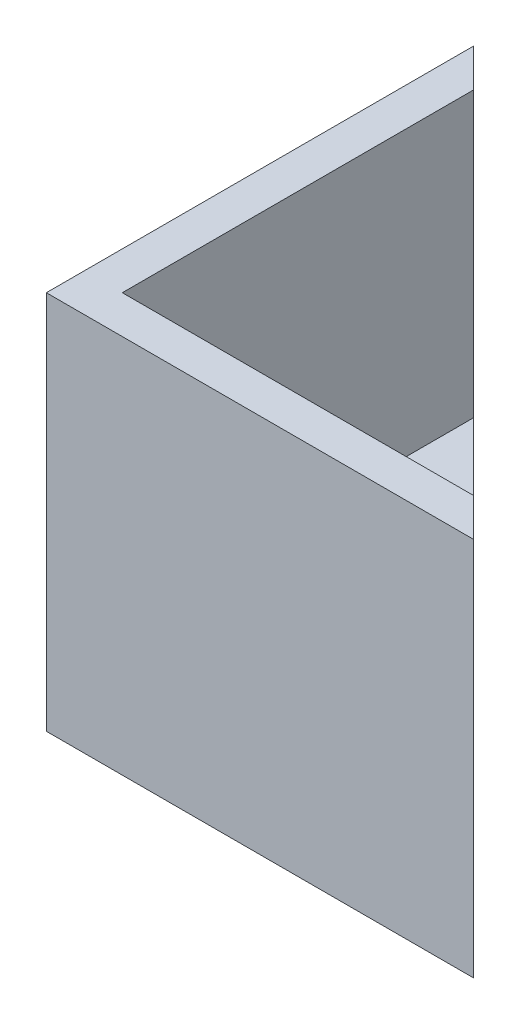
from build123d import *

# Parameters (mm, degrees)
BOSS_EXTRUDE1_DEPTH = 10.1
BOSS_EXTRUDE2_DEPTH = 29.9
CUT_EXTRUDE1_DEPTH  = 6.1
CUT_EXTRUDE2_DEPTH  = 71.313654435


with BuildPart() as part:
    # Sketch1 → Boss-Extrude1 (new body)
    with BuildSketch(Plane(origin=(0, 0, 0), x_dir=(1, 0, 0), z_dir=(0, 1, 0))):
        Polygon((0, 0), (45, 0), (0, 45), align=None)
    extrude(amount=BOSS_EXTRUDE1_DEPTH)

    # Sketch2 → Boss-Extrude2 (add)
    with BuildSketch(Plane(origin=(0, 10.1, 0), x_dir=(1, 0, 0), z_dir=(0, 1, 0))):
        Polygon((0, 0), (45, 0), (41, 4), (4, 4), (4, 41), (0, 45), align=None)
    extrude(amount=BOSS_EXTRUDE2_DEPTH)

    # Sketch3 → Cut-Extrude1 (cut)
    with BuildSketch(Plane(origin=(0, 10.1, 0), x_dir=(1, 0, 0), z_dir=(0, 1, 0))):
        with BuildLine():
            Line((12.535533906, 28.221825407), (28.221825407, 12.535533906))
            ThreePointArc((28.221825407, 12.535533906), (28.221825407, 5.464466094), (21.150757595, 5.464466094))
            Line((21.150757595, 5.464466094), (5.464466094, 21.150757595))
            ThreePointArc((5.464466094, 21.150757595), (5.464466094, 28.221825407), (12.535533906, 28.221825407))
        make_face()
    extrude(amount=-CUT_EXTRUDE1_DEPTH, mode=Mode.SUBTRACT)

    # Sketch5 → Cut-Extrude2 (cut, through all)
    with BuildSketch(Plane(origin=(0, 10.1, 0), x_dir=(1, 0, 0), z_dir=(0, 1, 0))):
        with BuildLine():
            Line((10.944543648, 26.630835149), (26.630835149, 10.944543648))
            ThreePointArc((26.630835149, 10.944543648), (26.630835149, 7.055456352), (22.741747853, 7.055456352))
            Line((22.741747853, 7.055456352), (7.055456352, 22.741747853))
            ThreePointArc((7.055456352, 22.741747853), (7.055456352, 26.630835149), (10.944543648, 26.630835149))
        make_face()
    extrude(amount=-CUT_EXTRUDE2_DEPTH, mode=Mode.SUBTRACT)


solid = part.part
